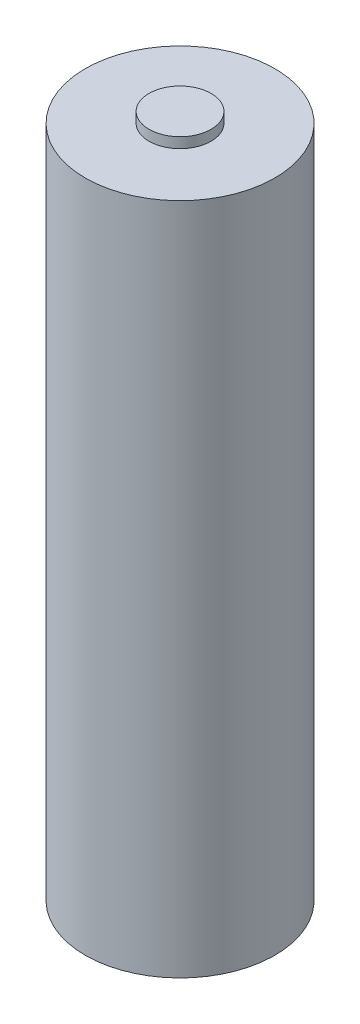
from build123d import *

# Parameters (mm, degrees)
SKETCH_1_R      = 9.15
EXTRUDE_1_DEPTH = 65
SKETCH_2_R      = 3
EXTRUDE_2_DEPTH = 1


with BuildPart() as part:
    # 草图1 → 凸台-拉伸1 (new body)
    with BuildSketch(Plane(origin=(0, 0, 0), x_dir=(1, 0, 0), z_dir=(0, 1, 0))):
        with Locations(Location((0, 0, 0), (0, 0, 270))):
            Circle(SKETCH_1_R)
    extrude(amount=EXTRUDE_1_DEPTH)

    # 草图2 → 凸台-拉伸2 (add)
    with BuildSketch(Plane(origin=(0, 65, 0), x_dir=(1, 0, 0), z_dir=(0, 1, 0))):
        with Locations(Location((0, 0, 0), (0, 0, 270))):
            Circle(SKETCH_2_R)
    extrude(amount=EXTRUDE_2_DEPTH)


solid = part.part
